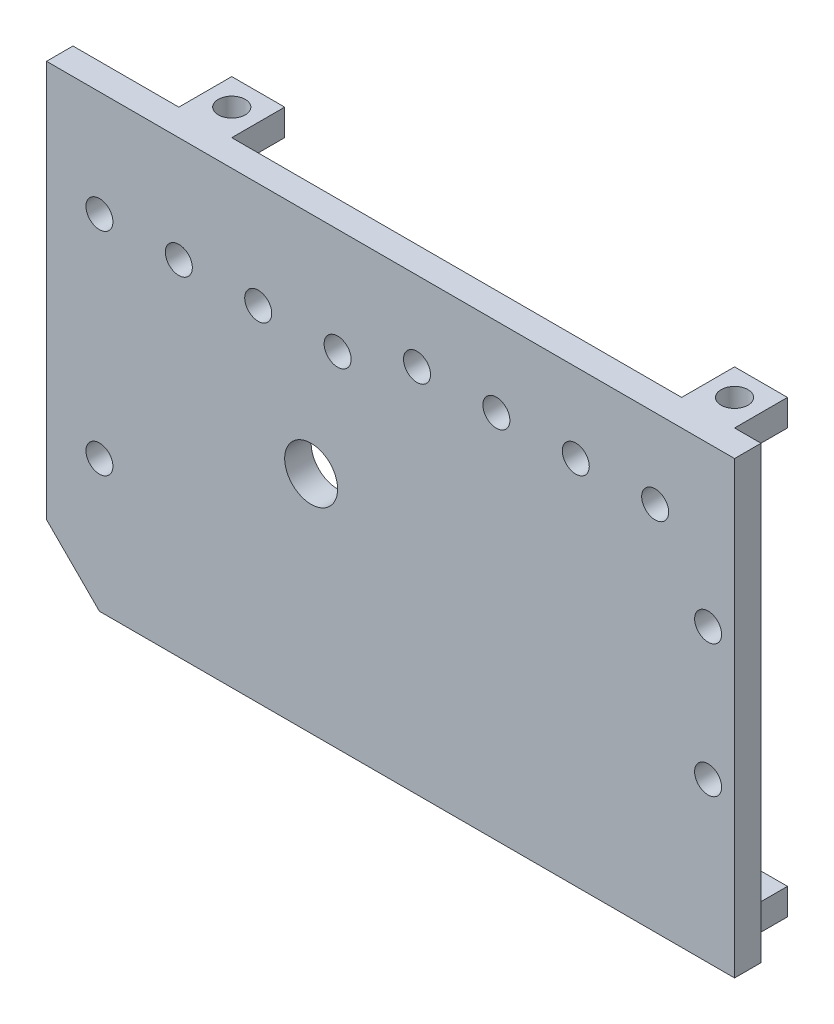
from build123d import *

# Parameters (mm, degrees)
SKETCH1_W           = 160
SKETCH1_H           = 85
SKETCH1_R           = 5
BOSS_EXTRUDE1_DEPTH = 5
SKETCH3_W           = 30
SKETCH3_H           = 85
CUT_EXTRUDE2_DEPTH  = 15
SKETCH5_R           = 2.55
CUT_EXTRUDE3_DEPTH  = 15
CHAMFER1_SIZE       = 10
SKETCH6_W           = 10
SKETCH6_H           = 5
BOSS_EXTRUDE2_DEPTH = 10
SKETCH7_R           = 2.55
CUT_EXTRUDE4_DEPTH  = 114.578166916
SKETCH8_R           = 2.55
CUT_EXTRUDE5_DEPTH  = 92.821838361


with BuildPart() as part:
    # Sketch1 → Boss-Extrude1 (new body)
    with BuildSketch(Plane.XY):
        Rectangle(SKETCH1_W, SKETCH1_H)
        Circle(SKETCH1_R, mode=Mode.SUBTRACT)
    extrude(amount=BOSS_EXTRUDE1_DEPTH)

    # Sketch3 → Cut-Extrude2 (cut)
    with BuildSketch(Plane.XY.offset(5)):
        with Locations((-65, 0)):
            Rectangle(SKETCH3_W, SKETCH3_H)
    extrude(amount=-CUT_EXTRUDE2_DEPTH, mode=Mode.SUBTRACT)

    # Sketch5 → Cut-Extrude3 (cut)
    with BuildSketch(Plane.XY.offset(5)):
        with Locations((65, 27.5)):
            Circle(SKETCH5_R)
        with Locations((50, 27.5)):
            Circle(SKETCH5_R)
        with Locations((35, 27.5)):
            Circle(SKETCH5_R)
        with Locations((20, 27.5)):
            Circle(SKETCH5_R)
        with Locations((5, 22.5)):
            Circle(SKETCH5_R)
        with Locations((-10, 22.5)):
            Circle(SKETCH5_R)
        with Locations((-25, 22.5)):
            Circle(SKETCH5_R)
        with Locations((-40, 22.5)):
            Circle(SKETCH5_R)
        with Locations((-40, -17.5)):
            Circle(SKETCH5_R)
    extrude(amount=-CUT_EXTRUDE3_DEPTH, mode=Mode.SUBTRACT)

    # Chamfer1
    chamfer1_edges = [part.edges().sort_by_distance(p)[0] for p in [
        (-50, -42.5, 2.5),
    ]]
    chamfer(chamfer1_edges, length=CHAMFER1_SIZE)

    # Sketch6 → Boss-Extrude2 (add)
    with BuildSketch(Plane(origin=(0, 0, 0), x_dir=(-1, 0, 0), z_dir=(0, 0, -1))):
        with Locations((-70, -40)):
            Rectangle(SKETCH6_W, SKETCH6_H)
        with Locations((25, -40)):
            Rectangle(SKETCH6_W, SKETCH6_H)
    boss_extrude2 = extrude(amount=BOSS_EXTRUDE2_DEPTH)

    # Sketch7 → Cut-Extrude4 (cut, through all)
    with BuildSketch(Plane(origin=(0, -37.5, 0), x_dir=(1, 0, 0), z_dir=(0, 1, 0))):
        with Locations(Location((70, 5, 0), (0, 0, 270))):
            Circle(SKETCH7_R)
        with Locations(Location((-25, 5, 0), (0, 0, 270))):
            Circle(SKETCH7_R)
    cut_extrude4 = extrude(amount=-CUT_EXTRUDE4_DEPTH, mode=Mode.SUBTRACT)

    # Mirror1: Boss-Extrude2 across plane
    add(boss_extrude2.mirror(Plane.ZX))

    # Mirror2: Cut-Extrude4 across plane
    add(cut_extrude4.mirror(Plane.ZX), mode=Mode.SUBTRACT)

    # Sketch8 → Cut-Extrude5 (cut, through all)
    with BuildSketch(Plane.XY.offset(5)):
        with Locations((75, 12.5)):
            Circle(SKETCH8_R)
        with Locations((75, -12.5)):
            Circle(SKETCH8_R)
    extrude(amount=-CUT_EXTRUDE5_DEPTH, mode=Mode.SUBTRACT)


solid = part.part
